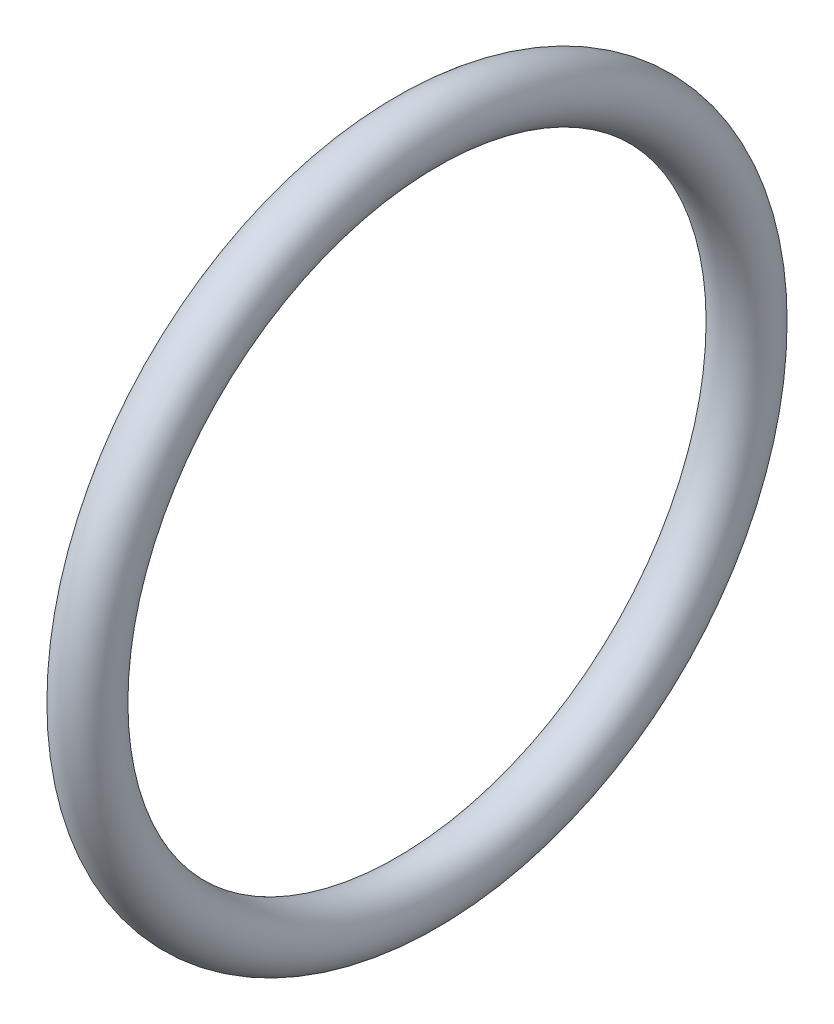
from build123d import *

# Parameters (mm, degrees)
ESQUISSE1_R = 2


with BuildPart() as part:
    # Esquisse1 → Révolution1 (revolve)
    with BuildSketch(Plane.XY, mode=Mode.PRIVATE) as r_volution1_sk:
        Circle(ESQUISSE1_R)
    revolve(r_volution1_sk.sketch.rotate(Axis((-4.852026709, -23, 0), (1, 0, 0)), 90), axis=Axis((-4.852026709, -23, 0), (1, 0, 0)))


solid = part.part
